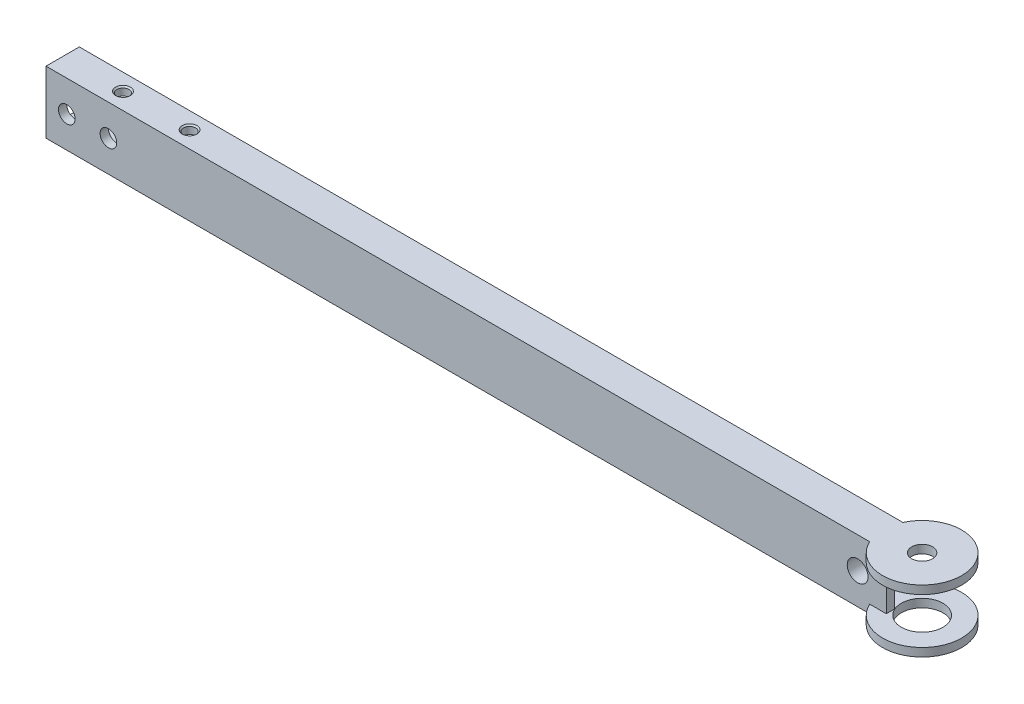
from build123d import *

# Parameters (mm, degrees)
SKETCH1_R                         = 5
BOSS_EXTRUDE3_DEPTH               = 2
SKETCH5_W                         = 2
SKETCH5_H                         = 11
BOSS_EXTRUDE4_DEPTH               = 197.88316
SKETCH6_R                         = 2.5
BOSS_EXTRUDE5_DEPTH               = 2
SKETCH8_W                         = 2
SKETCH8_H                         = 11
BOSS_EXTRUDE6_DEPTH               = 4
CUT_EXTRUDE8_REACH                = 209.363
SKETCH10_R                        = 2
SKETCH11_R                        = 4
SKETCH11_R_2                      = 2.5
BOSS_EXTRUDE7_DEPTH               = 4
CUT_EXTRUDE9_REACH                = 209.363
SKETCH12_R                        = 2.5
FILLET1_R                         = 1
M3_5X0_6_TAPPED_HOLE7_D           = 2.9
M3_5X0_6_TAPPED_HOLE7_DEPTH       = 2
M3_5X0_6_TAPPED_HOLE7_CSINK_D     = 3.55
M3_5X0_6_TAPPED_HOLE7_CSINK_ANGLE = 90


with BuildPart() as part:
    # Sketch1 → Boss-Extrude3 (new body)
    with BuildSketch(Plane(origin=(0, 0, 0), x_dir=(1, 0, 0), z_dir=(0, 1, 0))):
        with BuildLine():
            Line((-206.5, 4), (-8.61684397, 4))
            ThreePointArc((-8.61684397, 4), (9.5, 0), (-8.61684397, -4))
            Line((-8.61684397, -4), (-206.5, -4))
            Line((-206.5, -4), (-206.5, 4))
        make_face()
        with Locations(Location((0, 0, 0), (0, 0, 270))):
            Circle(SKETCH1_R, mode=Mode.SUBTRACT)
    extrude(amount=BOSS_EXTRUDE3_DEPTH)

    # Sketch5 → Boss-Extrude4 (add)
    with BuildSketch(Plane.ZY.offset(206.5)):
        with Locations((3, 7.5)):
            Rectangle(SKETCH5_W, SKETCH5_H)
    extrude(amount=-BOSS_EXTRUDE4_DEPTH)


with BuildPart() as boss_extrude5_tool:
    # Sketch6 → Boss-Extrude5 (new body)
    with BuildSketch(Plane(origin=(0, 13, 0), x_dir=(1, 0, 0), z_dir=(0, 1, 0))):
        with BuildLine():
            Line((-206.5, 4), (-8.61684397, 4))
            ThreePointArc((-8.61684397, 4), (9.5, 0), (-8.61684397, -4))
            Line((-8.61684397, -4), (-206.5, -4))
            Line((-206.5, -4), (-206.5, 4))
        make_face()
        with Locations(Location((0, 0, 0), (0, 0, 270))):
            Circle(SKETCH6_R, mode=Mode.SUBTRACT)
    extrude(amount=BOSS_EXTRUDE5_DEPTH)


with BuildPart() as part_1:
    add(part.part)


with BuildPart() as part_2:
    # Boss-Extrude5: joined with boss_extrude5_tool
    add(part_1.part.fuse(boss_extrude5_tool.part, tol=0.00001))

    # Sketch8 → Boss-Extrude6 (add)
    with BuildSketch(Plane(origin=(-8.61684397, 0, 0), x_dir=(0, 0, -1), z_dir=(1, 0, 0))):
        with Locations((-3, 7.5)):
            Rectangle(SKETCH8_W, SKETCH8_H)
    extrude(amount=BOSS_EXTRUDE6_DEPTH)

    # Sketch10 → Cut-Extrude8 (cut, up to next)
    with BuildSketch(Plane(origin=(0, 0, 2), x_dir=(-1, 0, 0), z_dir=(0, 0, -1)), mode=Mode.PRIVATE) as cut_extrude8_sk1:
        with Locations((201.5, 7.5)):
            Circle(SKETCH10_R)
    cut_extrude8_tool1 = extrude(cut_extrude8_sk1.sketch, amount=-CUT_EXTRUDE8_REACH, mode=Mode.PRIVATE) & part_2.part
    # Sketch10 → Cut-Extrude8 (cut, up to next)
    with BuildSketch(Plane(origin=(0, 0, 2), x_dir=(-1, 0, 0), z_dir=(0, 0, -1)), mode=Mode.PRIVATE) as cut_extrude8_sk2:
        with Locations((191.5, 7.5)):
            Circle(SKETCH10_R)
    cut_extrude8_tool2 = extrude(cut_extrude8_sk2.sketch, amount=-CUT_EXTRUDE8_REACH, mode=Mode.PRIVATE) & part_2.part
    add(cut_extrude8_tool1.solids().sort_by_distance((-201.5, 7.5, 2))[0], mode=Mode.SUBTRACT)
    add(cut_extrude8_tool2.solids().sort_by_distance((-191.5, 7.5, 2))[0], mode=Mode.SUBTRACT)

    # Sketch11 → Boss-Extrude7 (add)
    with BuildSketch(Plane(origin=(0, 0, 2), x_dir=(-1, 0, 0), z_dir=(0, 0, -1))):
        with Locations((11.5, 7.5)):
            Circle(SKETCH11_R)
        with Locations((11.5, 7.5)):
            Circle(SKETCH11_R_2, mode=Mode.SUBTRACT)
    extrude(amount=BOSS_EXTRUDE7_DEPTH)

    # Sketch12 → Cut-Extrude9 (cut, up to next)
    with BuildSketch(Plane(origin=(0, 0, 2), x_dir=(-1, 0, 0), z_dir=(0, 0, -1)), mode=Mode.PRIVATE) as cut_extrude9_sk1:
        with Locations((11.5, 7.5)):
            Circle(SKETCH12_R)
    cut_extrude9_tool1 = extrude(cut_extrude9_sk1.sketch, amount=-CUT_EXTRUDE9_REACH, mode=Mode.PRIVATE) & part_2.part
    add(cut_extrude9_tool1.solids().sort_by_distance((-11.5, 7.5, 2))[0], mode=Mode.SUBTRACT)

    # Fillet1
    fillet1_edges = [part_2.edges().sort_by_distance(p)[0] for p in [
        (-7.5, 7.5, 2),
    ]]
    fillet(fillet1_edges, radius=FILLET1_R)

    # M3.5x0.6 Tapped Hole7
    with Locations(Plane(origin=(0, 15, 0), x_dir=(1, 0, 0), z_dir=(0, 1, 0))):
        with Locations((-176, 0), (-192, 0)):
            CounterSinkHole(M3_5X0_6_TAPPED_HOLE7_D / 2, M3_5X0_6_TAPPED_HOLE7_CSINK_D / 2, depth=M3_5X0_6_TAPPED_HOLE7_DEPTH, counter_sink_angle=M3_5X0_6_TAPPED_HOLE7_CSINK_ANGLE)


solid = part_2.part
